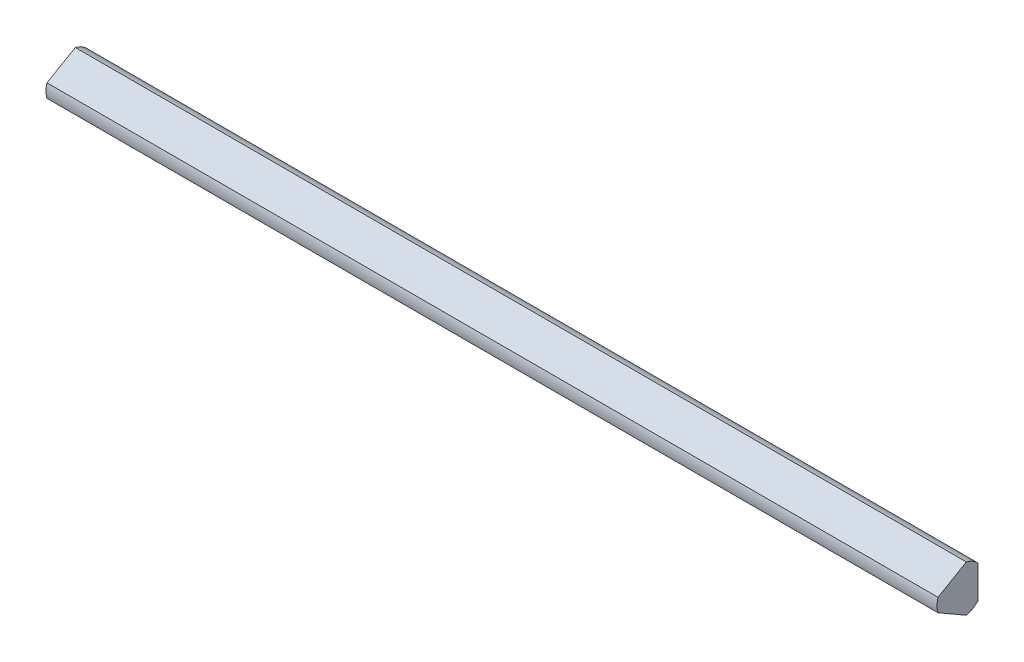
from build123d import *

# Parameters (mm, degrees)
BOSS_EXTRU_1_DEPTH = 75


with BuildPart() as part:
    # Esquisse1 → Boss.-Extru.1 (new body)
    with BuildSketch(Plane(origin=(0, 0, 0), x_dir=(0, 0, -1), z_dir=(1, 0, 0))):
        with BuildLine():
            Line((1.448022121, -1.379576725), (1.448022121, 1.379576723))
            ThreePointArc((1.448022121, 1.379576723), (1, 1.732050807), (0.470737428, 1.943812304))
            Line((0.470737428, 1.943812304), (-1.918759551, 0.56423558))
            ThreePointArc((-1.918759551, 0.56423558), (-1.979585702, 0.285027104), (-2, 0))
            ThreePointArc((-2, 0), (-1.979585702, -0.285027104), (-1.918759551, -0.564235579))
            Line((-1.918759551, -0.564235579), (0.470737429, -1.943812304))
            ThreePointArc((0.470737429, -1.943812304), (1, -1.732050808), (1.448022121, -1.379576725))
        make_face()
    extrude(amount=BOSS_EXTRU_1_DEPTH)


solid = part.part
